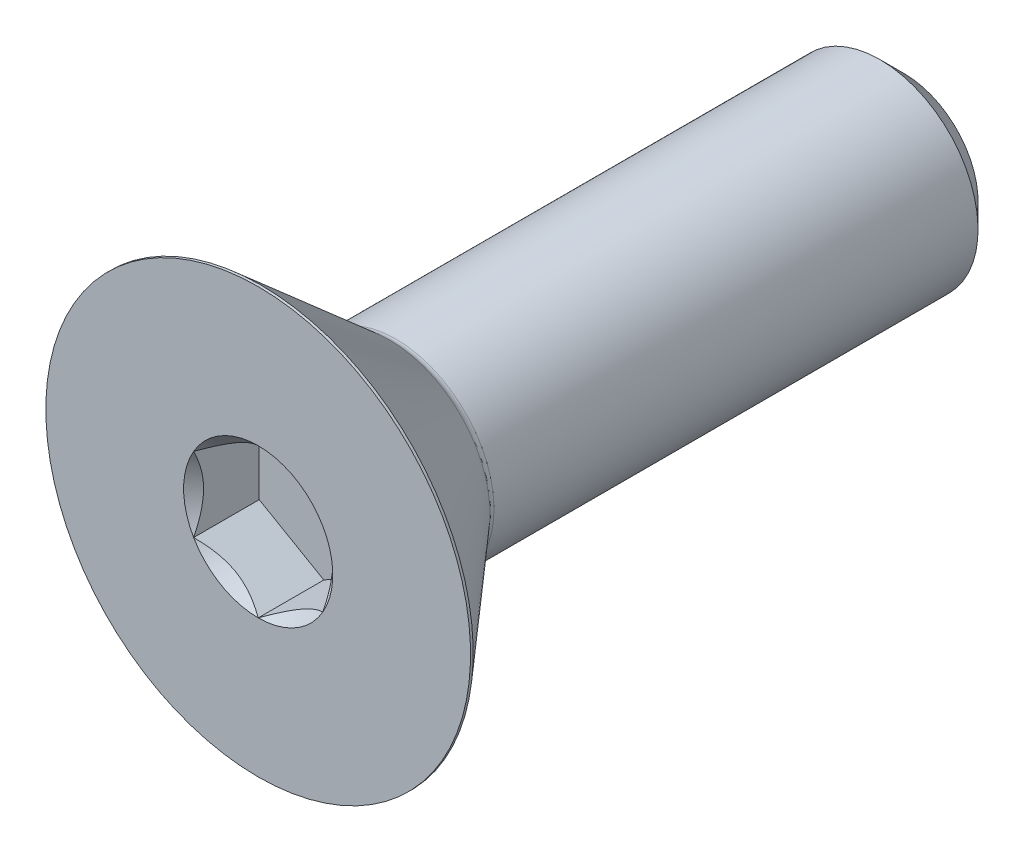
from build123d import *

# Parameters (mm, degrees)
SKETCH10_R         = 1.833087105
CUT_EXTRUDE2_DEPTH = 1.6129
CUT_EXTRUDE2_DRAFT = -45
CUT_EXTRUDE1_DEPTH = 1.6129


with BuildPart() as part:
    # Sketch2 → Revolve1 (revolve)
    with BuildSketch(Plane(origin=(0, 0, 0), x_dir=(0, 0, -1), z_dir=(1, 0, 0))):
        with BuildLine():
            Line((-7.872984, 5.2197), (-4.7117, 2.471637744))
            ThreePointArc((-4.7117, 2.471637744), (-4.63858483, 2.428138789), (-4.554866229, 2.413))
            Line((-4.554866229, 2.413), (7.3421875, 2.413))
            Line((7.3421875, 2.413), (7.9375, 1.8176875))
            Line((7.9375, 1.8176875), (7.9375, 0))
            Line((7.9375, 0), (-7.9375, 0))
            Line((-7.9375, 0), (-7.9375, 5.2197))
            Line((-7.9375, 5.2197), (-7.872984, 5.2197))
        make_face()
    revolve(axis=Axis((0, 0, -7.9375), (0, 0, 1)))


with BuildPart() as cut_extrude2_tool:
    # Sketch10 → Cut-Extrude2 (with draft: the straight prism first)
    with BuildSketch(Plane.XY.offset(7.9375)):
        Circle(SKETCH10_R)
    extrude(amount=-CUT_EXTRUDE2_DEPTH)
    # Cut-Extrude2: the draft: its side faces are tilted about the plane it starts from
    cut_extrude2_sides = [cut_extrude2_tool.faces().sort_by_distance(p)[0] for p in [
        (-1.833087105, 0, 7.13105),
    ]]
    draft(cut_extrude2_sides, Plane.XY.offset(7.9375), CUT_EXTRUDE2_DRAFT)


with BuildPart() as part_1:
    add(part.part)

    # Cut-Extrude2: cut by cut_extrude2_tool
    add(cut_extrude2_tool.part, mode=Mode.SUBTRACT)

    # Sketch9 → Cut-Extrude1 (cut)
    with BuildSketch(Plane.XY.offset(7.9375)):
        Polygon((1.5875, -0.916543552), (1.5875, 0.916543552), (0, 1.833087105), (-1.5875, 0.916543552), (-1.5875, -0.916543552), (0, -1.833087105), align=None)
    extrude(amount=-CUT_EXTRUDE1_DEPTH, mode=Mode.SUBTRACT)


solid = part_1.part
